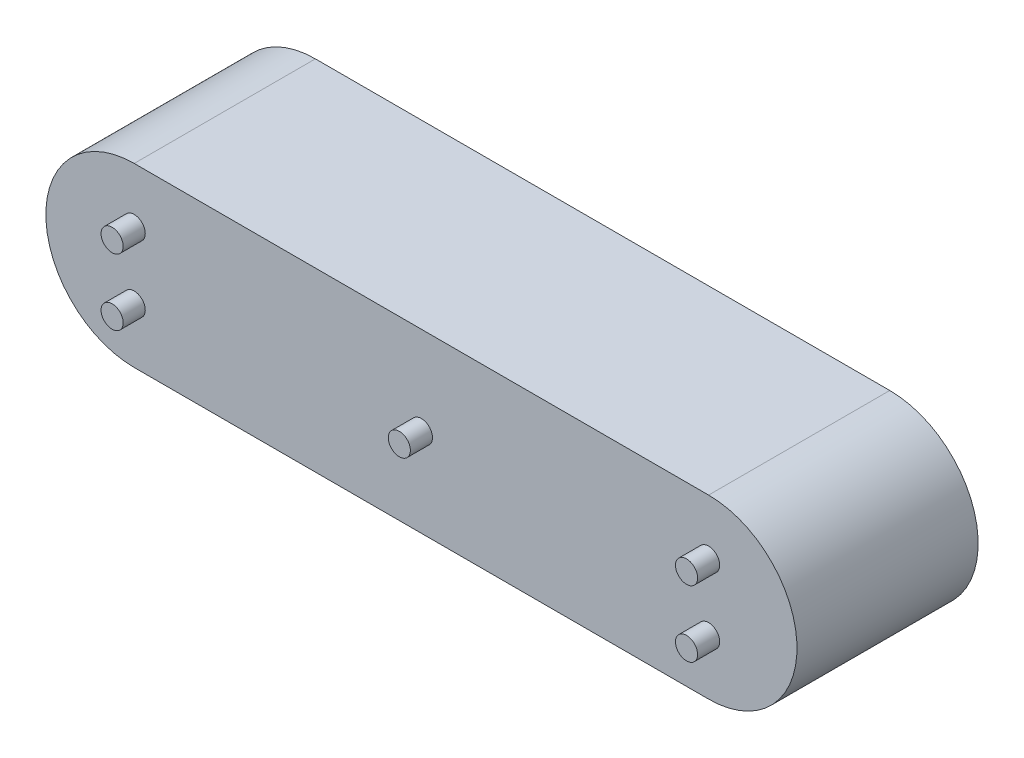
from build123d import *

# Parameters (mm, degrees)
BOSS_EXTRUDE1_DEPTH        = 5
BOSS_EXTRUDE1_DEPTH_BACK   = 46
SKETCH1_R                  = 2.5
BOSS_EXTRUDE1_2_DEPTH      = 5
BOSS_EXTRUDE1_2_DEPTH_BACK = 46
BOSS_EXTRUDE1_3_DEPTH      = 5
BOSS_EXTRUDE1_3_DEPTH_BACK = 46
BOSS_EXTRUDE1_4_DEPTH      = 5
BOSS_EXTRUDE1_4_DEPTH_BACK = 46
BOSS_EXTRUDE1_5_DEPTH      = 5
BOSS_EXTRUDE1_5_DEPTH_BACK = 46
BOSS_EXTRUDE2_DEPTH        = 41


with BuildPart() as part:
    # Sketch1 → Boss-Extrude1 (new, two sides: drawn at the far end of the back side and taken through both)
    with BuildSketch(Plane.XY.offset(-BOSS_EXTRUDE1_DEPTH_BACK)):
        Circle(SKETCH1_R)
    extrude(amount=BOSS_EXTRUDE1_DEPTH + BOSS_EXTRUDE1_DEPTH_BACK)



with BuildPart() as body_2:
    # Sketch1 → Boss-Extrude1 2 (new, two sides: drawn at the far end of the back side and taken through both)
    with BuildSketch(Plane.XY.offset(-BOSS_EXTRUDE1_2_DEPTH_BACK)):
        with Locations((0, 15)):
            Circle(SKETCH1_R)
    extrude(amount=BOSS_EXTRUDE1_2_DEPTH + BOSS_EXTRUDE1_2_DEPTH_BACK)


with BuildPart() as body_3:
    # Sketch1 → Boss-Extrude1 3 (new, two sides: drawn at the far end of the back side and taken through both)
    with BuildSketch(Plane.XY.offset(-BOSS_EXTRUDE1_3_DEPTH_BACK)):
        with Locations((-130, 15)):
            Circle(SKETCH1_R)
    extrude(amount=BOSS_EXTRUDE1_3_DEPTH + BOSS_EXTRUDE1_3_DEPTH_BACK)


with BuildPart() as body_4:
    # Sketch1 → Boss-Extrude1 4 (new, two sides: drawn at the far end of the back side and taken through both)
    with BuildSketch(Plane.XY.offset(-BOSS_EXTRUDE1_4_DEPTH_BACK)):
        with Locations((-130, 0)):
            Circle(SKETCH1_R)
    extrude(amount=BOSS_EXTRUDE1_4_DEPTH + BOSS_EXTRUDE1_4_DEPTH_BACK)


with BuildPart() as body_5:
    # Sketch1 → Boss-Extrude1 5 (new, two sides: drawn at the far end of the back side and taken through both)
    with BuildSketch(Plane.XY.offset(-BOSS_EXTRUDE1_5_DEPTH_BACK)):
        with Locations((-65, 7.5)):
            Circle(SKETCH1_R)
    extrude(amount=BOSS_EXTRUDE1_5_DEPTH + BOSS_EXTRUDE1_5_DEPTH_BACK)


with BuildPart() as part_1:
    add(part.part)

    add(body_2.part)  # Boss-Extrude2 merges body 2

    add(body_3.part)  # Boss-Extrude2 merges body 3

    add(body_4.part)  # Boss-Extrude2 merges body 4

    add(body_5.part)  # Boss-Extrude2 merges body 5
    # Sketch2 → Boss-Extrude2 (add)
    with BuildSketch(Plane.XY):
        with BuildLine():
            Line((-130, 27.5), (0, 27.5))
            ThreePointArc((0, 27.5), (20, 7.5), (0, -12.5))
            Line((0, -12.5), (-130, -12.5))
            ThreePointArc((-130, -12.5), (-150, 7.5), (-130, 27.5))
        make_face()
    extrude(amount=-BOSS_EXTRUDE2_DEPTH)


solid = part_1.part
